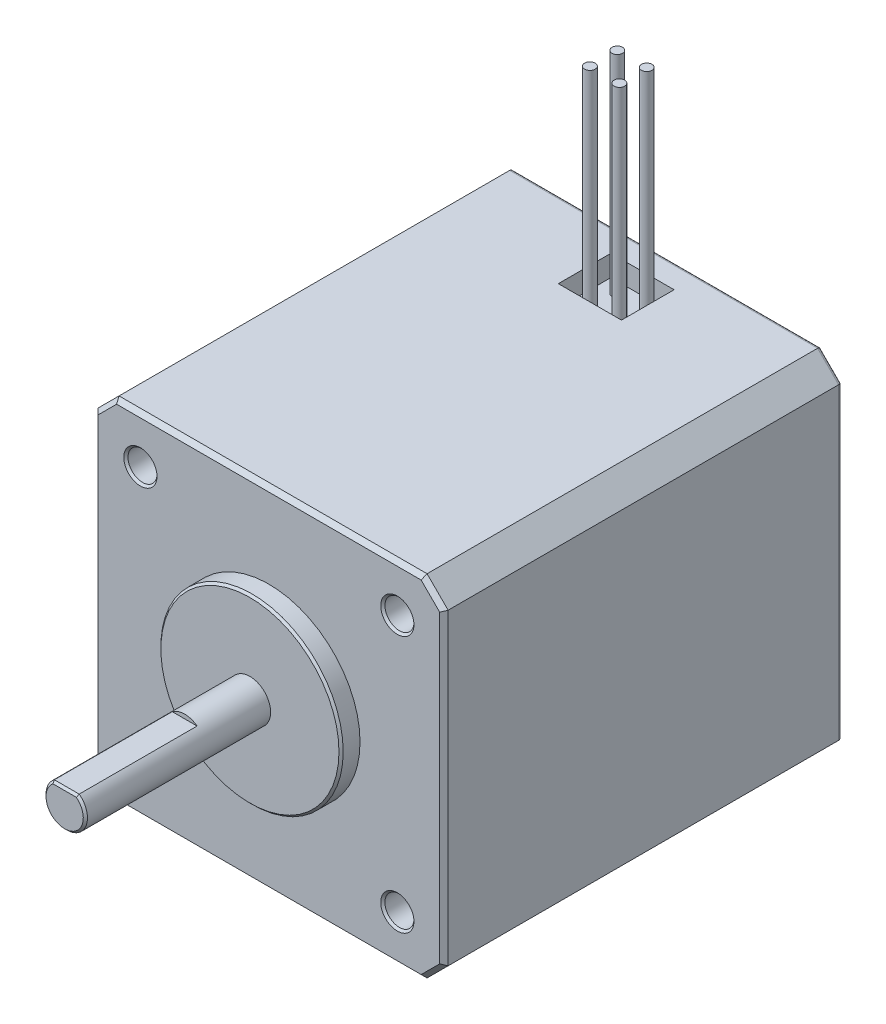
from build123d import *

# Parameters (mm, degrees)
ESQUISSE1_W                         = 48.006
ESQUISSE1_H                         = 42.242296956
BOSS_EXTRU_1_DEPTH                  = 42.242296957
ESQUISSE2_R                         = 11
BOSS_EXTRU_2_DEPTH                  = 2.286
ESQUISSE3_R                         = 2.5
BOSS_EXTRU_3_DEPTH                  = 22.352
ENL_V_START                         = -14.478
ENL_V_MAT_EXTRU_1_DEPTH             = 14.478
ESQUISSE5_W                         = 7.62
ESQUISSE5_H                         = 6.35
ENL_V_MAT_EXTRU_2_DEPTH             = 2.54
ESQUISSE6_W                         = 0.635
ESQUISSE6_H                         = 25.4
ESQUISSE7_W                         = 0.635
ESQUISSE7_H                         = 25.4
ESQUISSE8_W                         = 0.635
ESQUISSE8_H                         = 25.4
ESQUISSE9_W                         = 0.635
ESQUISSE9_H                         = 25.4
D_GAGEMENT_M81_D                    = 9.017
D_GAGEMENT_M81_DEPTH                = 4.191
DIAM_TRE_DU_PER_AGE_4_0_4_1_D       = 4
DIAM_TRE_DU_PER_AGE_4_0_4_1_DEPTH   = 4.191
DIAM_TRE_DU_PER_AGE_3_5_3_5_1_D     = 3.5
DIAM_TRE_DU_PER_AGE_3_5_3_5_1_DEPTH = 4.572
CHANFREIN1_SIZE                     = 0.254
CHANFREIN2_SIZE                     = 2.54
CHANFREIN3_SIZE                     = 0.508
CONG_1_R                            = 0.381


with BuildPart() as part:
    # Esquisse1 → Boss.-Extru.1 (new body)
    with BuildSketch(Plane(origin=(21.121148478, 0, 0), x_dir=(0, 0, -1), z_dir=(1, 0, 0))):
        with Locations((24.003, 0)):
            Rectangle(ESQUISSE1_W, ESQUISSE1_H)
    extrude(amount=-BOSS_EXTRU_1_DEPTH)

    # Esquisse2 → Boss.-Extru.2 (add)
    with BuildSketch(Plane.XY):
        Circle(ESQUISSE2_R)
    extrude(amount=BOSS_EXTRU_2_DEPTH)

    # Esquisse3 → Boss.-Extru.3 (add)
    with BuildSketch(Plane.XY.offset(2.286)):
        Circle(ESQUISSE3_R)
    extrude(amount=BOSS_EXTRU_3_DEPTH)

    # Esquisse4 → Enlèv. mat.-Extru.1 (cut)
    with BuildSketch(Plane.XY.offset(24.638).offset(ENL_V_START)):
        with BuildLine():
            Line((-1.5, 2), (1.5, 2))
            ThreePointArc((1.5, 2), (0, 2.5), (-1.5, 2))
        make_face()
    extrude(amount=ENL_V_MAT_EXTRU_1_DEPTH, mode=Mode.SUBTRACT)

    # Esquisse5 → Enlèv. mat.-Extru.2 (cut)
    with BuildSketch(Plane(origin=(0, 21.121148478, 0), x_dir=(-1, 0, 0), z_dir=(0, 1, 0))):
        with Locations((0, -41.91)):
            Rectangle(ESQUISSE5_W, ESQUISSE5_H)
    extrude(amount=-ENL_V_MAT_EXTRU_2_DEPTH, mode=Mode.SUBTRACT)

    # Esquisse6 → Révolution1 (revolve)
    with BuildSketch(Plane(origin=(0, 0, -43.815), x_dir=(-1, 0, 0), z_dir=(0, 0, -1)), mode=Mode.PRIVATE) as r_volution1_sk:
        with Locations((-2.0955, 31.281148478)):
            Rectangle(ESQUISSE6_W, ESQUISSE6_H)
    revolve(r_volution1_sk.sketch.rotate(Axis((1.778, 18.581148478, -43.815), (0, 1, 0)), 270), axis=Axis((1.778, 18.581148478, -43.815), (0, 1, 0)))

    # Esquisse7 → Révolution2 (revolve)
    with BuildSketch(Plane(origin=(0, 0, -40.513), x_dir=(-1, 0, 0), z_dir=(0, 0, -1)), mode=Mode.PRIVATE) as r_volution2_sk:
        with Locations((-2.0955, 31.281148478)):
            Rectangle(ESQUISSE7_W, ESQUISSE7_H)
    revolve(r_volution2_sk.sketch.rotate(Axis((1.778, 18.581148478, -40.513), (0, 1, 0)), 270), axis=Axis((1.778, 18.581148478, -40.513), (0, 1, 0)))

    # Esquisse8 → Révolution3 (revolve)
    with BuildSketch(Plane(origin=(0, 0, -43.815), x_dir=(-1, 0, 0), z_dir=(0, 0, -1)), mode=Mode.PRIVATE) as r_volution3_sk:
        with Locations((1.4605, 31.281148478)):
            Rectangle(ESQUISSE8_W, ESQUISSE8_H)
    revolve(r_volution3_sk.sketch.rotate(Axis((-1.778, 18.581148478, -43.815), (0, 1, 0)), 270), axis=Axis((-1.778, 18.581148478, -43.815), (0, 1, 0)))

    # Esquisse9 → Révolution4 (revolve)
    with BuildSketch(Plane(origin=(0, 0, -40.513), x_dir=(-1, 0, 0), z_dir=(0, 0, -1)), mode=Mode.PRIVATE) as r_volution4_sk:
        with Locations((1.4605, 31.281148478)):
            Rectangle(ESQUISSE9_W, ESQUISSE9_H)
    revolve(r_volution4_sk.sketch.rotate(Axis((-1.778, 18.581148478, -40.513), (0, 1, 0)), 270), axis=Axis((-1.778, 18.581148478, -40.513), (0, 1, 0)))

    # Dégagement M81
    with Locations(Plane(origin=(0, 0, -48.006), x_dir=(-1, 0, 0), z_dir=(0, 0, -1))):
        with Locations((0, 0)):
            Hole(D_GAGEMENT_M81_D / 2, depth=D_GAGEMENT_M81_DEPTH)

    # Diamètre du perçage Ø4.0 (4)1
    with Locations(Plane(origin=(0, 0, -48.006), x_dir=(-1, 0, 0), z_dir=(0, 0, -1))):
        with Locations((15.5, 15.5), (-15.5, -15.5), (15.5, -15.5), (-15.5, 15.5)):
            Hole(DIAM_TRE_DU_PER_AGE_4_0_4_1_D / 2, depth=DIAM_TRE_DU_PER_AGE_4_0_4_1_DEPTH)

    # Diamètre du perçage Ø3.5 (3.5)1
    with Locations(Plane.XY):
        with Locations((-15.5, 15.5), (15.5, 15.5), (-15.5, -15.5), (15.5, -15.5)):
            Hole(DIAM_TRE_DU_PER_AGE_3_5_3_5_1_D / 2, depth=DIAM_TRE_DU_PER_AGE_3_5_3_5_1_DEPTH)

    # Chanfrein1
    chanfrein1_edges = [part.edges().sort_by_distance(p)[0] for p in [
        (-11, 0, 2.286),
        (-1.118033989, -2.236067977, 24.638),
        (0, 2, 24.638),
        (-4.5085, 0, -48.006),
        (13.5, 15.5, -48.006),
        (-17.5, -15.5, -48.006),
        (13.5, -15.5, -48.006),
        (-17.5, 15.5, -48.006),
        (17.25, -15.5, 0),
        (-13.75, -15.5, 0),
        (17.25, 15.5, 0),
        (-13.75, 15.5, 0),
    ]]
    chamfer(chanfrein1_edges, length=CHANFREIN1_SIZE)

    # Chanfrein2
    chanfrein2_edges = [part.edges().sort_by_distance(p)[0] for p in [
        (-21.121148478, -21.121148478, -24.003),
        (-21.121148478, 21.121148478, -24.003),
        (21.121148478, -21.121148478, -24.003),
        (21.121148478, 21.121148478, -24.003),
    ]]
    chamfer(chanfrein2_edges, length=CHANFREIN2_SIZE)

    # Chanfrein3
    chanfrein3_edges = [part.edges().sort_by_distance(p)[0] for p in [
        (0, 21.121148478, 0),
        (21.121148478, 0, 0),
        (-21.121148478, 0, 0),
        (0, -21.121148478, 0),
        (19.851148478, -19.851148478, 0),
        (19.851148478, 19.851148478, 0),
        (-19.851148478, -19.851148478, 0),
        (-19.851148478, 19.851148478, 0),
    ]]
    chamfer(chanfrein3_edges, length=CHANFREIN3_SIZE)

    # Congé1
    cong_1_edges = [part.edges().sort_by_distance(p)[0] for p in [
        (0, 21.121148478, -48.006),
        (-21.121148478, 0, -48.006),
        (21.121148478, 0, -48.006),
        (0, -21.121148478, -48.006),
        (19.851148478, -19.851148478, -48.006),
        (19.851148478, 19.851148478, -48.006),
        (-19.851148478, -19.851148478, -48.006),
        (-19.851148478, 19.851148478, -48.006),
    ]]
    fillet(cong_1_edges, radius=CONG_1_R)


solid = part.part
